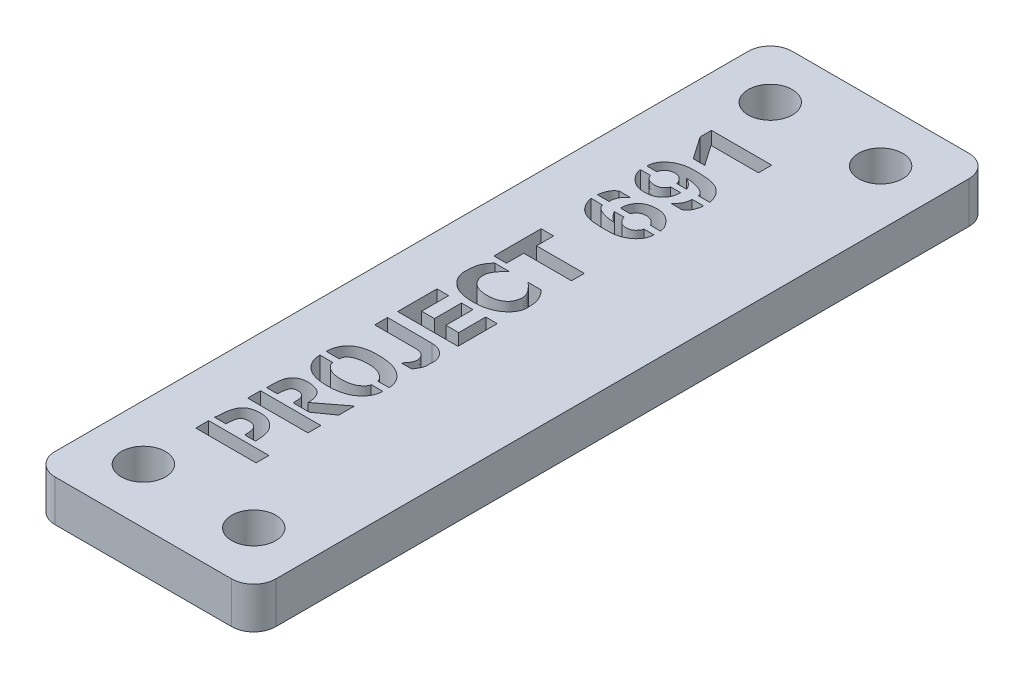
from build123d import *

# Parameters (mm, degrees)
SKETCH1_W           = 25.4
SKETCH1_H           = 84.836
BOSS_EXTRUDE1_DEPTH = 4.7625
FILLET1_R           = 2.54
SKETCH2_R           = 2.54
CUT_EXTRUDE1_DEPTH  = 4.7625
SKETCH3_W           = 6.937209635
SKETCH3_H           = 1.47773099
SKETCH3_H_2         = 1.477730989
CUT_EXTRUDE3_DEPTH  = 4.7625


with BuildPart() as part:
    # Sketch1 → Boss-Extrude1 (new body)
    with BuildSketch(Plane(origin=(0, 0, 0), x_dir=(1, 0, 0), z_dir=(0, 1, 0))):
        Rectangle(SKETCH1_W, SKETCH1_H)
    extrude(amount=BOSS_EXTRUDE1_DEPTH)

    # Fillet1
    fillet1_edges = [part.edges().sort_by_distance(p)[0] for p in [
        (-12.7, 2.38125, -42.418),
        (12.7, 2.38125, -42.418),
        (12.7, 2.38125, 42.418),
        (-12.7, 2.38125, 42.418),
    ]]
    fillet(fillet1_edges, radius=FILLET1_R)

    # Sketch2 → Cut-Extrude1 (cut)
    with BuildSketch(Plane(origin=(0, 4.7625, 0), x_dir=(1, 0, 0), z_dir=(0, 1, 0))):
        with Locations(Location((6.35, 36.068, 0), (0, 0, 270))):
            Circle(SKETCH2_R)
        with Locations(Location((-6.35, 36.068, 0), (0, 0, 270))):
            Circle(SKETCH2_R)
        with Locations(Location((6.35, -36.068, 0), (0, 0, 270))):
            Circle(SKETCH2_R)
        with Locations(Location((-6.35, -36.068, 0), (0, 0, 270))):
            Circle(SKETCH2_R)
    extrude(amount=-CUT_EXTRUDE1_DEPTH, mode=Mode.SUBTRACT)

    # Sketch3 → Cut-Extrude3 (cut)
    with BuildSketch(Plane(origin=(0, 4.7625, 0), x_dir=(1, 0, 0), z_dir=(0, 1, 0))):
        with BuildLine():
            Line((-2.204557943, -27.318811646), (-3.432489193, -27.318811646))
            add(Edge.make_bspline(
                [(-3.432489193, -27.318811646), (-3.432086244, -27.242043489), (-3.43131662, -27.095417788), (-3.444434951, -26.885090985), (-3.462893716, -26.694079451), (-3.490651172, -26.521824011), (-3.529286887, -26.369068947), (-3.578036003, -26.235963855), (-3.631503271, -26.119599112), (-3.700606609, -26.024876261), (-3.774751798, -25.94326573), (-3.859309551, -25.875236157), (-3.951313004, -25.81606595), (-4.052326275, -25.767662454), (-4.162419043, -25.732227657), (-4.279993593, -25.704130858), (-4.407280254, -25.690675175), (-4.539497775, -25.684071819), (-4.67120632, -25.68931151), (-4.795938487, -25.700663902), (-4.911135214, -25.720321161), (-5.01728325, -25.746758344), (-5.113551653, -25.782898874), (-5.20018799, -25.826377302), (-5.276644926, -25.878356426), (-5.345910846, -25.939667647), (-5.405748322, -26.021181454), (-5.455121107, -26.126788682), (-5.500796447, -26.257094486), (-5.534324196, -26.415150462), (-5.566678309, -26.59815323), (-5.589264627, -26.808329507), (-5.607848058, -27.044153478), (-5.613179732, -27.210425561), (-5.615979687, -27.297744198)],
                knots=[0, 0, 0, 0, 1.620059853, 3.094283102, 4.446036624, 5.669764395, 6.774058916, 7.765531304, 8.660548686, 9.465545705, 10.229819932, 10.982267153, 11.748884886, 12.535069155, 13.338672239, 14.18627352, 15.081979594, 16.035876351, 16.978779197, 17.861689262, 18.67809544, 19.443395835, 20.167134492, 20.8442956, 21.484521806, 22.114153355, 22.787578946, 23.602060283, 24.566476989, 25.696612031, 27.007394411, 28.488900441, 30.156128049, 32, 32, 32, 32], degree=3))
            Line((-5.615979687, -27.297744198), (-6.926675911, -27.297744198))
            add(Edge.make_bspline(
                [(-6.926675911, -27.297744198), (-6.921712564, -27.18334754), (-6.912149702, -26.962939926), (-6.889474751, -26.645831121), (-6.861772416, -26.354612775), (-6.825780895, -26.090107298), (-6.783941902, -25.851579213), (-6.736724336, -25.638719824), (-6.681792385, -25.45199614), (-6.619050018, -25.289274235), (-6.549930048, -25.145269935), (-6.475368605, -25.013851842), (-6.391670351, -24.895266674), (-6.304488565, -24.785514263), (-6.20972416, -24.687152478), (-6.106551853, -24.601539985), (-5.998363784, -24.525480797), (-5.84144082, -24.439916569), (-5.624638239, -24.353975928), (-5.338004568, -24.280368922), (-5.019882446, -24.239015253), (-4.73772238, -24.225933909), (-4.503107017, -24.233735716), (-4.327486567, -24.249429272), (-4.156796234, -24.278965653), (-3.990195633, -24.3168429), (-3.8297448, -24.371191099), (-3.672415085, -24.431572528), (-3.521002812, -24.506675475), (-3.374664778, -24.591583863), (-3.235441884, -24.686356673), (-3.104154991, -24.787205163), (-2.981621264, -24.89435255), (-2.868204891, -25.008408891), (-2.766398735, -25.131578913), (-2.670787271, -25.258608179), (-2.586590412, -25.394214474), (-2.508470134, -25.536587596), (-2.43904046, -25.693136489), (-2.382088863, -25.868028067), (-2.330052116, -26.061697568), (-2.28953676, -26.275159671), (-2.254184606, -26.507963608), (-2.229965258, -26.760683599), (-2.211124708, -27.033142019), (-2.206795653, -27.221466011), (-2.204557943, -27.318811646)],
                knots=[0, 0, 0, 0, 1.699189764, 3.273822559, 4.717445749, 6.039702003, 7.234168391, 8.310453345, 9.273716079, 10.119740721, 10.895518061, 11.642474635, 12.359027655, 13.047258987, 13.721088708, 14.381587928, 15.034110984, 15.680490903, 17.029629755, 18.483046039, 20.061106175, 21.782264105, 22.668591867, 23.543372224, 24.396343774, 25.237738208, 26.075767183, 26.907923794, 27.736877995, 28.580804131, 29.416979643, 30.23438941, 31.03619414, 31.831023051, 32.618286661, 33.405866943, 34.188612909, 34.984695714, 35.814585228, 36.725577301, 37.711441232, 38.788832536, 39.947912176, 41.204878494, 42.555187395, 44, 44, 44, 44], degree=3))
        make_face()
        with Locations((-3.468604818, -28.712272844)):
            Rectangle(SKETCH3_W, SKETCH3_H)
        with Locations((-3.468604818, -22.741156178)):
            Rectangle(SKETCH3_W, SKETCH3_H_2)
        with BuildLine():
            add(Edge.make_bspline(
                [(-3.84781888, -21.337161256), (-3.847753872, -21.265926003), (-3.847629287, -21.129407572), (-3.856412298, -20.93355259), (-3.873130803, -20.756378239), (-3.89422301, -20.597685736), (-3.925514345, -20.458660199), (-3.964855298, -20.338957205), (-4.008862139, -20.236185284), (-4.063781239, -20.151428397), (-4.128253534, -20.083185163), (-4.195373034, -20.020966344), (-4.273923765, -19.972273328), (-4.358233929, -19.928678985), (-4.451978172, -19.898349054), (-4.552643244, -19.875213633), (-4.66106172, -19.862255319), (-4.774288702, -19.857911775), (-4.88643986, -19.862473824), (-4.992170249, -19.874073649), (-5.088903823, -19.893580882), (-5.176763692, -19.919831106), (-5.254934344, -19.956278497), (-5.322499717, -20.001998193), (-5.382848358, -20.053485938), (-5.434618007, -20.116041305), (-5.477796034, -20.195189439), (-5.513801737, -20.29396158), (-5.548974097, -20.41391277), (-5.577494774, -20.55710614), (-5.604854555, -20.722633409), (-5.626833921, -20.910969515), (-5.644452056, -21.121798523), (-5.65341092, -21.269924536), (-5.658114583, -21.34769498)],
                knots=[0, 0, 0, 0, 1.704020633, 3.265661473, 4.687782663, 5.960558721, 7.092940044, 8.090949425, 8.971855951, 9.760657708, 10.491171539, 11.213658047, 11.942593241, 12.693902549, 13.479411519, 14.291598235, 15.162311024, 16.087000325, 16.999698994, 17.845156185, 18.628829851, 19.357567475, 20.033937485, 20.682928481, 21.303797403, 21.926056331, 22.613721948, 23.449414641, 24.436762231, 25.60173672, 26.93927573, 28.450017959, 30.1361567, 32, 32, 32, 32], degree=3))
            Line((-5.658114583, -21.34769498), (-6.907113281, -21.34769498))
            add(Edge.make_bspline(
                [(-6.907113281, -21.34769498), (-6.90682114, -21.22980228), (-6.906261587, -21.003997057), (-6.894238821, -20.680482609), (-6.881787593, -20.38717533), (-6.856193437, -20.1249368), (-6.829476564, -19.892639907), (-6.793612056, -19.691165929), (-6.752510206, -19.519862307), (-6.68978001, -19.334857686), (-6.588099061, -19.139505957), (-6.442249963, -18.935053685), (-6.263862306, -18.767229212), (-6.060311779, -18.632384798), (-5.834664977, -18.53161419), (-5.593774188, -18.45675038), (-5.337194887, -18.413966326), (-5.069279876, -18.399775581), (-4.797286243, -18.412218728), (-4.527748811, -18.448112576), (-4.264957544, -18.509025033), (-4.051778129, -18.577795298), (-3.888464716, -18.647363989), (-3.773840392, -18.708883966), (-3.667821705, -18.780352169), (-3.569622631, -18.859951386), (-3.480426153, -18.949258895), (-3.399855969, -19.048142343), (-3.328371497, -19.156577345), (-3.240615154, -19.313216413), (-3.153034087, -19.528605262), (-3.080046601, -19.808970902), (-3.033969671, -20.11273115), (-3.028839124, -20.323744903), (-3.026188411, -20.432765813)],
                knots=[0, 0, 0, 0, 1.545689895, 2.960529795, 4.244762436, 5.394017444, 6.414580785, 7.309945393, 8.075641602, 8.72251512, 9.866752923, 10.949451079, 12.000892828, 13.058917368, 14.136147873, 15.230450672, 16.35823801, 17.537386422, 18.742157286, 19.923486542, 21.0977639, 22.274984682, 22.855342685, 23.423306737, 23.977859707, 24.529479651, 25.078269143, 25.629889087, 26.199032476, 26.779092248, 27.98221028, 29.234586207, 30.571240389, 32, 32, 32, 32], degree=3))
            Line((-3.026188411, -20.432765813), (0, -18.122870631))
            Line((0, -18.122870631), (0, -19.933166334))
            Line((0, -19.933166334), (-1.986359375, -21.337161256))
            Line((-1.986359375, -21.337161256), (-3.84781888, -21.337161256))
        make_face()
        with BuildLine():
            add(Edge.make_bspline(
                [(-1.17526263, -14.302138469), (-1.176933137, -14.270320689), (-1.180340607, -14.205419324), (-1.211408481, -14.10939091), (-1.259105899, -14.013500009), (-1.324990391, -13.916470126), (-1.409867757, -13.818610025), (-1.514991417, -13.721397576), (-1.636947573, -13.622137312), (-1.775605988, -13.523710973), (-1.92952388, -13.430176335), (-2.099041038, -13.349129248), (-2.280756724, -13.280266035), (-2.47540848, -13.223881852), (-2.682505224, -13.183037248), (-2.902068659, -13.152836031), (-3.134201346, -13.134649564), (-3.375341466, -13.131311582), (-3.61626525, -13.137306834), (-3.848870711, -13.15140983), (-4.068120674, -13.177746639), (-4.275819162, -13.210050723), (-4.471102199, -13.252966051), (-4.653462371, -13.308176594), (-4.824324934, -13.368543178), (-4.980858056, -13.440815051), (-5.121393437, -13.521277307), (-5.245691328, -13.608116842), (-5.348101515, -13.705591479), (-5.434800426, -13.808282107), (-5.500001896, -13.920980862), (-5.545735921, -14.041376551), (-5.571841994, -14.169580802), (-5.57416518, -14.25737723), (-5.575349609, -14.302138469)],
                knots=[0, 0, 0, 0, 0.559551673, 1.141363957, 1.762179237, 2.443913102, 3.20250351, 4.040654274, 4.964481152, 5.97279125, 7.03575374, 8.135123237, 9.279679308, 10.457759393, 11.702785314, 12.996979229, 14.362738502, 15.804190176, 17.245831659, 18.610331059, 19.909950123, 21.136790735, 22.314472596, 23.430673126, 24.493525292, 25.506283696, 26.464789682, 27.34564422, 28.171296493, 28.950175142, 29.70690828, 30.454076609, 31.211842126, 32, 32, 32, 32], degree=3))
            Line((-5.575349609, -14.302138469), (-7.072643229, -14.302138469))
            add(Edge.make_bspline(
                [(-7.072643229, -14.302138469), (-7.070053996, -14.205688359), (-7.064974851, -14.016487887), (-7.024691446, -13.739763459), (-6.960781089, -13.476069688), (-6.868281915, -13.22693284), (-6.750778594, -12.991505893), (-6.604026538, -12.772136693), (-6.433764246, -12.565290762), (-6.236821326, -12.372530739), (-6.01076592, -12.197738151), (-5.750124588, -12.051409606), (-5.460800465, -11.924891132), (-5.13802578, -11.827830796), (-4.785007759, -11.750581216), (-4.399835445, -11.701093834), (-3.983692041, -11.674714797), (-3.546103019, -11.672385111), (-3.107073646, -11.692760084), (-2.686691187, -11.734918395), (-2.295496895, -11.802582549), (-1.933081824, -11.892281141), (-1.59861989, -12.004436696), (-1.292824692, -12.141467058), (-1.015849258, -12.302270854), (-0.770312417, -12.486814989), (-0.554714903, -12.686293548), (-0.36247581, -12.891080884), (-0.204973892, -13.108560267), (-0.070943722, -13.330171343), (0.029185523, -13.562592647), (0.105113723, -13.801550129), (0.146968569, -14.049869881), (0.153311394, -14.217727225), (0.156501042, -14.302138469)],
                knots=[0, 0, 0, 0, 0.920346871, 1.805389965, 2.663603329, 3.505921104, 4.336769663, 5.169437479, 6.019773897, 6.889978583, 7.795002015, 8.738717905, 9.735886095, 10.803615248, 11.950360416, 13.182160892, 14.506515913, 15.928648215, 17.357110269, 18.700219705, 19.958946806, 21.143485947, 22.260957422, 23.321793063, 24.336827028, 25.311708212, 26.247066261, 27.138304861, 27.987778048, 28.805680415, 29.605441448, 30.397525795, 31.194155961, 32, 32, 32, 32], degree=3))
            Line((0.156501042, -14.302138469), (-1.17526263, -14.302138469))
        make_face()
        with BuildLine():
            add(Edge.make_bspline(
                [(0.156501042, -15.03047024), (0.153682672, -15.1199529), (0.148104172, -15.297069145), (0.101349859, -15.557277814), (0.026212212, -15.80828382), (-0.082116267, -16.048061729), (-0.218545806, -16.279332634), (-0.386976583, -16.498830253), (-0.584534167, -16.709478238), (-0.810458157, -16.908603269), (-1.065092754, -17.090834972), (-1.346085708, -17.250971347), (-1.653418937, -17.38507378), (-1.98612729, -17.492130722), (-2.343135439, -17.578387266), (-2.725502238, -17.639413191), (-3.133326905, -17.67454055), (-3.556880155, -17.685710937), (-3.978977862, -17.67481494), (-4.381566132, -17.638977775), (-4.756468423, -17.581251044), (-5.103159616, -17.499520659), (-5.421722405, -17.392494242), (-5.711549193, -17.262130559), (-5.973515335, -17.107787394), (-6.205448706, -16.929811976), (-6.408609528, -16.733376267), (-6.58593024, -16.524578273), (-6.737467082, -16.304868716), (-6.860372979, -16.072456399), (-6.955862639, -15.828611624), (-7.023367495, -15.572644415), (-7.065142939, -15.3052195), (-7.070119512, -15.122918576), (-7.072643229, -15.03047024)],
                knots=[0, 0, 0, 0, 0.853788275, 1.689933833, 2.515604473, 3.349525323, 4.195487693, 5.073811264, 5.985247159, 6.948898209, 7.944298668, 8.969549936, 10.03104821, 11.139619114, 12.302323729, 13.534477937, 14.832609361, 16.207589621, 17.577782735, 18.861604178, 20.063875084, 21.196402976, 22.258020076, 23.267502423, 24.225161109, 25.154278776, 26.051819322, 26.918259964, 27.765739173, 28.594805511, 29.42276458, 30.260307849, 31.117768349, 32, 32, 32, 32], degree=3))
            Line((-7.072643229, -15.03047024), (-5.596417057, -15.03047024))
            add(Edge.make_bspline(
                [(-5.596417057, -15.03047024), (-5.59418075, -15.063796608), (-5.589630293, -15.131609384), (-5.558360923, -15.231422111), (-5.515055036, -15.332306207), (-5.451762082, -15.431565785), (-5.372985397, -15.531242211), (-5.276876069, -15.630499075), (-5.165845271, -15.731248558), (-5.038232395, -15.830259566), (-4.894168149, -15.924618009), (-4.730936409, -16.004564907), (-4.55257462, -16.074781774), (-4.357017638, -16.128804518), (-4.145897111, -16.175601915), (-3.917067755, -16.203045001), (-3.672661376, -16.223892169), (-3.416924159, -16.22838678), (-3.16077646, -16.223552934), (-2.91399163, -16.204200131), (-2.682886983, -16.171123665), (-2.466737835, -16.127075987), (-2.266854536, -16.067430889), (-2.08132654, -15.997918566), (-1.911297476, -15.913275878), (-1.758987956, -15.815372223), (-1.624246377, -15.712317058), (-1.505022047, -15.610972656), (-1.404417058, -15.511199701), (-1.321562253, -15.412104382), (-1.256175433, -15.315267527), (-1.210055351, -15.219007303), (-1.180810879, -15.124473852), (-1.177079775, -15.061258001), (-1.17526263, -15.03047024)],
                knots=[0, 0, 0, 0, 0.586688794, 1.193799336, 1.831051319, 2.517875258, 3.260615898, 4.067157841, 4.949574073, 5.90085298, 6.911050796, 7.978417371, 9.097950677, 10.284242926, 11.549887516, 12.905094796, 14.34172073, 15.871388074, 17.409892715, 18.855330142, 20.230456225, 21.522043046, 22.738739217, 23.902689247, 25.009587917, 26.078746574, 27.088247994, 27.99718535, 28.834762146, 29.581751398, 30.270676851, 30.887491563, 31.458179498, 32, 32, 32, 32], degree=3))
            Line((-1.17526263, -15.03047024), (0.156501042, -15.03047024))
        make_face()
        with BuildLine():
            Line((-6.926675911, -8.874260995), (-6.926675911, -7.396530006))
            Line((-6.926675911, -7.396530006), (-1.810295703, -7.40706373))
            add(Edge.make_bspline(
                [(-1.810295703, -7.40706373), (-1.737491363, -7.41052985), (-1.594878071, -7.417319483), (-1.386499947, -7.445032674), (-1.190774984, -7.493028043), (-1.004816741, -7.551940229), (-0.831688895, -7.631543927), (-0.667975095, -7.724305188), (-0.516521254, -7.835432556), (-0.378172376, -7.960777291), (-0.25412853, -8.096328746), (-0.143167563, -8.235530312), (-0.05141616, -8.380838461), (0.024520868, -8.528792311), (0.084108043, -8.680887215), (0.12645489, -8.837251454), (0.150201643, -8.99790952), (0.160156589, -9.20874337), (0.153890153, -9.45467783), (0.146907522, -9.720699429), (0.131465329, -9.943996328), (0.115783383, -10.107177103), (0.090863992, -10.227974972), (0.057980888, -10.324364871), (0.012549682, -10.432105779), (-0.045635935, -10.551906857), (-0.115460621, -10.683485682), (-0.201493097, -10.825532778), (-0.298437732, -10.979808985), (-0.369393692, -11.085527797), (-0.406300781, -11.140516464)],
                knots=[0, 0, 0, 0, 1.215774492, 2.38152841, 3.499943313, 4.574381322, 5.630576831, 6.672721368, 7.70883401, 8.757576902, 9.782134528, 10.77153606, 11.723382411, 12.644074726, 13.542320429, 14.443640527, 15.340755012, 16.245951772, 17.961585553, 19.443669169, 20.685038119, 21.696074975, 22.17535241, 22.739034778, 23.391781445, 24.125402853, 24.96028863, 25.875946883, 26.89519331, 28, 28, 28, 28], degree=3))
            Line((-0.406300781, -11.140516464), (-1.611659766, -11.140516464))
            add(Edge.make_bspline(
                [(-1.611659766, -11.140516464), (-1.555645054, -11.078522913), (-1.448822709, -10.960298677), (-1.308906829, -10.779901208), (-1.189713752, -10.610321257), (-1.096478603, -10.447986801), (-1.024765342, -10.294953361), (-0.979608093, -10.149658065), (-0.953773005, -10.01284842), (-0.960902551, -9.846074019), (-0.998009172, -9.656944514), (-1.071881974, -9.451413305), (-1.1813056, -9.275221289), (-1.298666603, -9.153224388), (-1.406713319, -9.070208795), (-1.499099073, -9.017699508), (-1.60115052, -8.974763671), (-1.711287435, -8.936162059), (-1.831903376, -8.908199982), (-1.961795014, -8.889231691), (-2.100994033, -8.876914629), (-2.197006503, -8.87516594), (-2.246692839, -8.874260995)],
                knots=[0, 0, 0, 0, 1.52682091, 2.911709905, 4.170758681, 5.312664321, 6.330329213, 7.252596346, 8.089247554, 8.859715672, 10.287649864, 11.599132905, 12.830633069, 14.049885, 14.671597463, 15.31647816, 15.985924738, 16.693474089, 17.447450553, 18.244998475, 19.091788859, 20, 20, 20, 20], degree=3))
            Line((-2.246692839, -8.874260995), (-6.926675911, -8.874260995))
        make_face()
        Polygon((-6.9342, -6.224277011), (-6.9342, -1.699290162), (-5.585883333, -1.699290162), (-5.585883333, -4.809748365), (-4.114171615, -4.809748365), (-4.114171615, -1.699290162), (-2.792941667, -1.699290162), (-2.792941667, -4.809748365), (-1.321229948, -4.809748365), (-1.321229948, -1.699290162), (0, -1.699290162), (0, -6.224277011), align=None)
        with BuildLine():
            add(Edge.make_bspline(
                [(-0.842697917, 4.192071166), (-0.769155384, 4.11651892), (-0.623127453, 3.966500452), (-0.428226109, 3.721399238), (-0.259086872, 3.461441745), (-0.132648637, 3.234829883), (-0.047733057, 3.039675523), (0.007232967, 2.87911242), (0.054255663, 2.704721472), (0.091015358, 2.516010768), (0.12107844, 2.313702338), (0.142178703, 2.097237217), (0.1528624, 1.867244059), (0.159707987, 1.626778524), (0.147385278, 1.381060154), (0.099928562, 1.138647294), (0.020709213, 0.903047376), (-0.090344043, 0.675055398), (-0.231516128, 0.453788697), (-0.404676742, 0.240816424), (-0.609932145, 0.036006896), (-0.842400789, -0.161257333), (-1.102267116, -0.343066786), (-1.386043775, -0.503262375), (-1.69320913, -0.637433939), (-2.023236361, -0.744898813), (-2.374785527, -0.830773906), (-2.749026303, -0.892300224), (-3.145853845, -0.927323762), (-3.556880642, -0.938638188), (-3.965949957, -0.927603002), (-4.357625146, -0.89195761), (-4.723517118, -0.832736517), (-5.064457338, -0.74861917), (-5.379696315, -0.640294932), (-5.671176081, -0.509967095), (-5.936091205, -0.352707463), (-6.173623719, -0.171991912), (-6.382760992, 0.025535856), (-6.568631257, 0.22948743), (-6.723081502, 0.445205546), (-6.850134276, 0.668667619), (-6.95100804, 0.900372388), (-7.021642789, 1.140989481), (-7.064882009, 1.389977952), (-7.074850144, 1.642832456), (-7.071570956, 1.890868097), (-7.058179175, 2.127074934), (-7.044003615, 2.347762777), (-7.016911492, 2.551808091), (-6.987231377, 2.740710659), (-6.945184801, 2.912849843), (-6.902237168, 3.070867947), (-6.827899923, 3.257914716), (-6.719513587, 3.477719511), (-6.563606885, 3.728919105), (-6.379609839, 3.968979798), (-6.239341642, 4.117032031), (-6.168247786, 4.192071166)],
                knots=[0, 0, 0, 0, 1.142102602, 2.267788091, 3.386469574, 4.500532407, 5.075110759, 5.690534852, 6.337967116, 7.030899795, 7.772743646, 8.553780998, 9.38659623, 10.267348619, 11.16047737, 12.046381184, 12.93508228, 13.846776553, 14.787737289, 15.77335943, 16.815008932, 17.925831272, 19.073418424, 20.246596944, 21.451460151, 22.699425793, 24.003318156, 25.369697712, 26.805256227, 28.317037304, 29.823384826, 31.237291449, 32.575969623, 33.836339543, 35.037948929, 36.183770988, 37.29034247, 38.36882713, 39.411043808, 40.404177068, 41.354558347, 42.279605007, 43.185365136, 44.086628527, 44.991001142, 45.916383134, 46.824228694, 47.678758263, 48.480056567, 49.219686519, 49.908684965, 50.550801302, 51.139176072, 51.681260279, 52.729033148, 53.790965847, 54.880368043, 56, 56, 56, 56], degree=3))
            Line((-6.168247786, 4.192071166), (-4.451250781, 4.192071166))
            add(Edge.make_bspline(
                [(-4.451250781, 4.192071166), (-4.545595179, 4.108424617), (-4.726484314, 3.948046765), (-4.969959057, 3.699645969), (-5.174444541, 3.456039217), (-5.340277169, 3.217507363), (-5.468565723, 2.984886842), (-5.560088003, 2.757411227), (-5.611269613, 2.533819734), (-5.622588252, 2.316762554), (-5.603795688, 2.110828345), (-5.571478966, 1.915829236), (-5.522324346, 1.732301504), (-5.45372998, 1.561839046), (-5.370669601, 1.401816101), (-5.270009135, 1.253473736), (-5.149106912, 1.119692032), (-5.015364731, 0.995112517), (-4.864239579, 0.885138398), (-4.697531826, 0.790900478), (-4.517921002, 0.708306259), (-4.322534928, 0.644916536), (-4.113824759, 0.593685961), (-3.89112755, 0.555628488), (-3.653581358, 0.536057126), (-3.406908278, 0.528170842), (-3.159230082, 0.536086437), (-2.920295161, 0.555860089), (-2.695152433, 0.592511351), (-2.483448858, 0.641260841), (-2.285845645, 0.706472568), (-2.100909846, 0.784238604), (-1.93039185, 0.878163131), (-1.773170576, 0.984886379), (-1.631412505, 1.105021915), (-1.507014715, 1.23823385), (-1.400414858, 1.38430151), (-1.312302881, 1.542922335), (-1.238213506, 1.712616528), (-1.187010542, 1.895705891), (-1.15098072, 2.090096905), (-1.129858317, 2.295424925), (-1.136410198, 2.513113664), (-1.191731208, 2.737102226), (-1.282805687, 2.96796972), (-1.418077593, 3.202490392), (-1.591803852, 3.443661125), (-1.80770186, 3.688990614), (-2.060133584, 3.944944065), (-2.250865254, 4.107259202), (-2.35052526, 4.192071166)],
                knots=[0, 0, 0, 0, 1.644457997, 3.152964999, 4.532843094, 5.788876873, 6.936739459, 7.991466232, 8.977304869, 9.914492674, 10.81384118, 11.670143911, 12.49082873, 13.286722025, 14.062344171, 14.839152306, 15.617859763, 16.409734935, 17.219891492, 18.049372533, 18.904474348, 19.794249952, 20.724260177, 21.706421881, 22.73783236, 23.831091397, 24.924350434, 25.968796894, 26.956349637, 27.897549355, 28.799749926, 29.667551167, 30.510955973, 31.334947132, 32.142642367, 32.929717677, 33.707159434, 34.495267687, 35.292612216, 36.116837179, 36.96900467, 37.869495086, 38.806043048, 39.793335612, 40.862637167, 42.034641504, 43.314850825, 44.734359334, 46.293656371, 48, 48, 48, 48], degree=3))
            Line((-2.35052526, 4.192071166), (-0.842697917, 4.192071166))
        make_face()
        Polygon((-6.9342, 4.855695776), (-6.9342, 10.285078067), (-5.489575, 10.285078067), (-5.489575, 8.318281322), (0, 8.318281322), (0, 6.842055151), (-5.489575, 6.842055151), (-5.489575, 4.855695776), align=None)
        with BuildLine():
            add(Edge.make_bspline(
                [(-5.751413281, 16.907780802), (-5.749215461, 16.984683116), (-5.74488097, 17.136348105), (-5.70701531, 17.358732387), (-5.648874903, 17.573241165), (-5.563726077, 17.77962671), (-5.450960019, 17.97869527), (-5.308881161, 18.17089911), (-5.139007888, 18.358207246), (-5.007807394, 18.471628998), (-4.940316536, 18.529974291)],
                knots=[0, 0, 0, 0, 0.981416672, 1.935527552, 2.872649936, 3.814794331, 4.77857579, 5.786904786, 6.861561505, 8, 8, 8, 8], degree=3))
            Line((-4.940316536, 18.529974291), (-6.189315234, 18.529974291))
            add(Edge.make_bspline(
                [(-6.189315234, 18.529974291), (-6.230373017, 18.504535397), (-6.311612887, 18.45420018), (-6.424654108, 18.368315422), (-6.526412863, 18.274750497), (-6.619783282, 18.176689433), (-6.701110714, 18.070265007), (-6.773516088, 17.957728936), (-6.835253885, 17.838023673), (-6.902918196, 17.675950201), (-6.965375757, 17.480249218), (-7.025977085, 17.265418812), (-7.063575025, 17.077615935), (-7.069797312, 16.961080967), (-7.072643229, 16.907780802)],
                knots=[0, 0, 0, 0, 0.902701417, 1.786149687, 2.649151757, 3.485131382, 4.314244312, 5.149329194, 5.984045373, 6.828816213, 8.430272808, 9.820342073, 11.003079253, 12, 12, 12, 12], degree=3))
            Line((-7.072643229, 16.907780802), (-5.751413281, 16.907780802))
        make_face()
        with BuildLine():
            add(Edge.make_bspline(
                [(-3.275988151, 16.907780802), (-3.271472985, 16.936853378), (-3.260925134, 17.004769637), (-3.19995319, 17.108849219), (-3.105417788, 17.226292967), (-3.007471412, 17.335577247), (-2.909610972, 17.422526039), (-2.825854647, 17.482904508), (-2.733495927, 17.532921439), (-2.635019648, 17.575186594), (-2.528326882, 17.606567263), (-2.415006009, 17.6290616), (-2.294174951, 17.642431342), (-2.168467067, 17.64633171), (-2.041991202, 17.643202597), (-1.919781218, 17.625795255), (-1.803510134, 17.600348247), (-1.692524289, 17.566274453), (-1.588519672, 17.519540467), (-1.491766882, 17.460917003), (-1.399090162, 17.395744068), (-1.317085632, 17.318728261), (-1.243137862, 17.242191786), (-1.176254385, 17.172609945), (-1.119156261, 17.111268204), (-1.071971018, 17.057882167), (-1.037371693, 17.010659545), (-1.011940058, 16.972760331), (-0.992370219, 16.943626411), (-0.989726183, 16.924488858), (-0.988665234, 16.916809708)],
                knots=[0, 0, 0, 0, 0.848617324, 1.982449431, 3.436545942, 5.240768766, 6.231652679, 7.234248317, 8.231856677, 9.276340032, 10.341049835, 11.455338972, 12.628184927, 13.867293084, 15.106401241, 16.297295494, 17.446097863, 18.561148647, 19.663179848, 20.747543236, 21.843297207, 22.946771928, 24.007887427, 24.935260928, 25.749674447, 26.44180137, 27.004159656, 27.444606052, 27.777142173, 28, 28, 28, 28], degree=3))
            Line((-0.988665234, 16.916809708), (0.156501042, 16.916809708))
            add(Edge.make_bspline(
                [(0.156501042, 16.916809708), (0.154509189, 16.970144389), (0.150450726, 17.078815523), (0.115381471, 17.241517099), (0.060283162, 17.405741311), (-0.015776273, 17.572203299), (-0.113863452, 17.740299816), (-0.234505949, 17.909367015), (-0.374596287, 18.081403886), (-0.535087588, 18.251193317), (-0.708905864, 18.415102084), (-0.899419935, 18.5562271), (-1.099760707, 18.676827436), (-1.310994886, 18.774098075), (-1.532330797, 18.852339967), (-1.764698968, 18.905335891), (-2.007358557, 18.939285958), (-2.256243642, 18.948392518), (-2.503095447, 18.939244307), (-2.739776194, 18.91476061), (-2.962432497, 18.871076079), (-3.171253776, 18.809587888), (-3.365735094, 18.729619432), (-3.546572364, 18.633426101), (-3.711314326, 18.517667221), (-3.862241262, 18.387123025), (-3.995702326, 18.241039595), (-4.112536564, 18.083130344), (-4.212656202, 17.914711059), (-4.291786984, 17.733748737), (-4.356565307, 17.543341129), (-4.398432169, 17.340587606), (-4.426951015, 17.127792167), (-4.430087576, 16.982117853), (-4.431688151, 16.907780802)],
                knots=[0, 0, 0, 0, 0.750355394, 1.528873324, 2.332989369, 3.186468007, 4.101149326, 5.069252908, 6.10844306, 7.222788785, 8.357455092, 9.46783137, 10.554430822, 11.644697357, 12.737066891, 13.854162738, 14.99494648, 16.182633948, 17.355930564, 18.471372678, 19.529710703, 20.546576165, 21.531666437, 22.486067545, 23.424654872, 24.360900384, 25.290755979, 26.204782513, 27.123029643, 28.043176503, 28.981311889, 29.949724638, 30.953752245, 32, 32, 32, 32], degree=3))
            Line((-4.431688151, 16.907780802), (-3.275988151, 16.907780802))
        make_face()
        with BuildLine():
            Line((0.167034766, 16.168915307), (-0.97813151, 16.168915307))
            add(Edge.make_bspline(
                [(-0.97813151, 16.168915307), (-0.984082939, 16.127663033), (-0.997128094, 16.037240664), (-1.068436363, 15.901983661), (-1.170099069, 15.752746028), (-1.281787375, 15.624164081), (-1.386338389, 15.521185154), (-1.475638921, 15.451851781), (-1.571433815, 15.394212714), (-1.673085329, 15.344341061), (-1.782004596, 15.309950765), (-1.896270635, 15.280876287), (-2.017634672, 15.267960547), (-2.142856443, 15.260527576), (-2.267604273, 15.267843524), (-2.388407862, 15.281087241), (-2.5018066, 15.309665508), (-2.609593915, 15.344470672), (-2.709650926, 15.393692859), (-2.802867691, 15.452904924), (-2.891749874, 15.52021824), (-2.993216817, 15.625202735), (-3.102060302, 15.756815566), (-3.202031108, 15.913828071), (-3.267785111, 16.06333098), (-3.280542409, 16.162883959), (-3.286521875, 16.209545385)],
                knots=[0, 0, 0, 0, 0.927475074, 2.032966586, 3.375798686, 4.976803487, 5.834806498, 6.659437564, 7.501332334, 8.335396756, 9.187940833, 10.054359069, 10.971160572, 11.915823181, 12.860485791, 13.766139725, 14.632557961, 15.474452731, 16.298394914, 17.121187677, 17.945818743, 18.787788451, 20.384333895, 21.761999943, 22.951028129, 24, 24, 24, 24], degree=3))
            Line((-3.286521875, 16.209545385), (-4.431688151, 16.209545385))
            add(Edge.make_bspline(
                [(-4.431688151, 16.209545385), (-4.43033138, 16.204965798), (-4.42634918, 16.191524452), (-4.410990235, 16.168396225), (-4.390429985, 16.132468079), (-4.358273424, 16.08724439), (-4.319164159, 16.029249096), (-4.271234281, 15.960347427), (-4.213804932, 15.880762977), (-4.12510099, 15.757919093), (-3.992306514, 15.598975766), (-3.79642281, 15.422596807), (-3.566834061, 15.255251892), (-3.396441555, 15.158480741), (-3.307589323, 15.108018822)],
                knots=[0, 0, 0, 0, 0.107234925, 0.314740585, 0.61909808, 1.04234032, 1.562795012, 2.196197582, 2.933359156, 3.774392159, 5.611037011, 7.587220186, 9.698928515, 12, 12, 12, 12], degree=3))
            add(Edge.make_bspline(
                [(-3.307589323, 15.108018822), (-3.396427634, 15.112798938), (-3.570352881, 15.122157319), (-3.824272558, 15.148294809), (-4.065220443, 15.181163702), (-4.292955134, 15.220999277), (-4.50712411, 15.271358881), (-4.709076494, 15.327404792), (-4.897600926, 15.394419445), (-5.072557629, 15.466538729), (-5.229319114, 15.546193307), (-5.368180131, 15.62702524), (-5.485450235, 15.711987446), (-5.581521697, 15.799714206), (-5.658009859, 15.88920577), (-5.710955481, 15.983298011), (-5.745343946, 16.080309135), (-5.749400759, 16.146575375), (-5.751413281, 16.179449031)],
                knots=[0, 0, 0, 0, 1.499814804, 2.936296909, 4.302182762, 5.59947636, 6.832403556, 8.010357135, 9.131089549, 10.20385637, 11.198577165, 12.09348467, 12.910514558, 13.634730622, 14.283349854, 14.885477346, 15.447102571, 16, 16, 16, 16], degree=3))
            Line((-5.751413281, 16.179449031), (-7.072643229, 16.189982755))
            add(Edge.make_bspline(
                [(-7.072643229, 16.189982755), (-7.072225471, 16.169353526), (-7.071322508, 16.124764522), (-7.056657178, 16.054402908), (-7.041915423, 15.973851223), (-7.014075207, 15.885295953), (-6.984383653, 15.785967725), (-6.94120358, 15.679532111), (-6.898092446, 15.561756348), (-6.825156149, 15.396185164), (-6.72127449, 15.188853674), (-6.567367539, 14.955532129), (-6.384238624, 14.743469374), (-6.176122517, 14.549426977), (-5.938986702, 14.378717066), (-5.671938824, 14.235130783), (-5.377551436, 14.116952243), (-5.110335629, 14.039099462), (-4.874872056, 13.99033156), (-4.673114958, 13.95718399), (-4.448577152, 13.930984579), (-4.201696527, 13.908620392), (-3.932288452, 13.890390059), (-3.640229995, 13.879015397), (-3.325687586, 13.872011874), (-2.995041466, 13.867164324), (-2.660435678, 13.876464036), (-2.334863018, 13.905259328), (-2.025691105, 13.958438047), (-1.732480793, 14.030777563), (-1.454188775, 14.12141925), (-1.193480651, 14.236890841), (-0.947945933, 14.370592503), (-0.722093029, 14.525538475), (-0.516341268, 14.693993268), (-0.336454436, 14.875137853), (-0.182463953, 15.065627116), (-0.057090941, 15.26690343), (0.042738645, 15.477551505), (0.11106089, 15.699686358), (0.156645934, 15.930834852), (0.16354514, 16.08894368), (0.167034766, 16.168915307)],
                knots=[0, 0, 0, 0, 0.258221721, 0.558132818, 0.898640276, 1.28488583, 1.720575915, 2.19841396, 2.72412238, 3.293240168, 4.466418006, 5.628394464, 6.788325788, 7.972365138, 9.18920409, 10.441809878, 11.765322105, 13.160831415, 13.925755206, 14.779982171, 15.724097867, 16.760064261, 17.888611064, 19.11002675, 20.425140591, 21.834293582, 23.256653412, 24.621237559, 25.92947289, 27.18665111, 28.406072673, 29.59473182, 30.757474276, 31.907297446, 33.024443337, 34.087556567, 35.103387964, 36.089590438, 37.054866171, 38.017802335, 38.997402139, 40, 40, 40, 40], degree=3))
        make_face()
        with BuildLine():
            Line((0.145967318, 21.900765958), (-1.17526263, 21.900765958))
            add(Edge.make_bspline(
                [(-1.17526263, 21.900765958), (-1.177505176, 21.823876114), (-1.181927875, 21.67223572), (-1.219172279, 21.449538092), (-1.279765212, 21.235571565), (-1.364329989, 21.028895771), (-1.477194531, 20.829802452), (-1.61935432, 20.6381586), (-1.787615358, 20.449836818), (-1.918763819, 20.336821814), (-1.986359375, 20.278572468)],
                knots=[0, 0, 0, 0, 0.981732815, 1.936151043, 2.87530384, 3.817751729, 4.781843651, 5.79049746, 6.86119478, 8, 8, 8, 8], degree=3))
            Line((-1.986359375, 20.278572468), (-0.738865495, 20.278572468))
            add(Edge.make_bspline(
                [(-0.738865495, 20.278572468), (-0.697772937, 20.303975459), (-0.61646426, 20.354239637), (-0.504194003, 20.440439298), (-0.400546562, 20.532094206), (-0.309654668, 20.632327809), (-0.224777199, 20.73626278), (-0.153477858, 20.849518801), (-0.090981036, 20.968610693), (-0.026354222, 21.131918856), (0.039361283, 21.326371051), (0.099379051, 21.542137812), (0.136812594, 21.730442469), (0.143102564, 21.847467266), (0.145967318, 21.900765958)],
                knots=[0, 0, 0, 0, 0.902130626, 1.785020279, 2.641190041, 3.483499652, 4.310496615, 5.14505346, 5.979241836, 6.819881233, 8.423313641, 9.812503944, 11.003709621, 12, 12, 12, 12], degree=3))
        make_face()
        with BuildLine():
            Line((-2.496492578, 21.900765958), (-3.65068776, 21.900765958))
            add(Edge.make_bspline(
                [(-3.65068776, 21.900765958), (-3.66087209, 21.86706198), (-3.683401725, 21.792502494), (-3.75358808, 21.683582261), (-3.845247914, 21.560797211), (-3.942901086, 21.456233997), (-4.033075561, 21.370188456), (-4.114186325, 21.315350734), (-4.201067173, 21.266170747), (-4.297738207, 21.228985272), (-4.401527199, 21.199300958), (-4.513047717, 21.175904295), (-4.633110229, 21.165142382), (-4.798419333, 21.159120606), (-4.998077375, 21.16995232), (-5.219055164, 21.207617209), (-5.411854946, 21.271659652), (-5.575684099, 21.362430476), (-5.708198852, 21.475862466), (-5.817849104, 21.599858222), (-5.899517838, 21.739318621), (-5.933185259, 21.839867469), (-5.950049219, 21.890232234)],
                knots=[0, 0, 0, 0, 0.715897332, 1.583698414, 2.622319798, 3.84739399, 4.499884924, 5.161953047, 5.840456042, 6.534702953, 7.270546337, 8.043928196, 8.85724736, 9.72842699, 11.421000357, 12.929892975, 14.293570183, 15.550098503, 16.727797181, 17.83879812, 18.917457273, 20, 20, 20, 20], degree=3))
            Line((-5.950049219, 21.890232234), (-7.093710677, 21.890232234))
            add(Edge.make_bspline(
                [(-7.093710677, 21.890232234), (-7.091726863, 21.836893881), (-7.087684778, 21.728215267), (-7.052487746, 21.565572051), (-6.997838565, 21.4009136), (-6.919550374, 21.235236861), (-6.821926549, 21.06672405), (-6.701219088, 20.897235167), (-6.559455475, 20.725715078), (-6.397652504, 20.555738883), (-6.222341163, 20.392452257), (-6.031619654, 20.250252812), (-5.830137328, 20.130706762), (-5.618358146, 20.032516483), (-5.396234635, 19.955017967), (-5.16350335, 19.901648531), (-4.920815742, 19.867770199), (-4.671940078, 19.858653595), (-4.425079995, 19.867767803), (-4.187931418, 19.892438899), (-3.964725147, 19.935803264), (-3.755783631, 19.99712822), (-3.562103964, 20.077808188), (-3.381596666, 20.173576551), (-3.216846958, 20.289369461), (-3.066028447, 20.419978621), (-2.93187292, 20.566070409), (-2.816659435, 20.72507808), (-2.714598074, 20.892833829), (-2.636852847, 21.074516958), (-2.571528744, 21.265162763), (-2.529772914, 21.467971197), (-2.501223231, 21.680751386), (-2.498090963, 21.826427823), (-2.496492578, 21.900765958)],
                knots=[0, 0, 0, 0, 0.749496382, 1.527123058, 2.330318545, 3.185763752, 4.099397937, 5.066393227, 6.108867918, 7.226779668, 8.365339679, 9.474444789, 10.565860266, 11.654878656, 12.752660777, 13.868477764, 15.007955528, 16.194283322, 17.366236738, 18.480401886, 19.544451134, 20.560152481, 21.537592667, 22.49090117, 23.428413994, 24.363587685, 25.292378774, 26.211038861, 27.122163358, 28.047706306, 28.984767707, 29.952071809, 30.954949998, 32, 32, 32, 32], degree=3))
        make_face()
        with BuildLine():
            add(Edge.make_bspline(
                [(-2.496492578, 22.586962833), (-2.511079468, 22.626513157), (-2.542310225, 22.711191013), (-2.612936437, 22.836384351), (-2.705431129, 22.967800965), (-2.816451039, 23.109732091), (-2.959992926, 23.256646931), (-3.14445029, 23.401072511), (-3.366833916, 23.548608932), (-3.531624736, 23.640972657), (-3.619086589, 23.689994213)],
                knots=[0, 0, 0, 0, 0.627447975, 1.343375806, 2.133407235, 3.021854083, 4.026238314, 5.185535451, 6.506237888, 8, 8, 8, 8], degree=3))
            add(Edge.make_bspline(
                [(-3.619086589, 23.689994213), (-3.530253171, 23.685184253), (-3.356835894, 23.675794428), (-3.103272669, 23.650151513), (-2.863086799, 23.614903755), (-2.635252061, 23.575478716), (-2.420773725, 23.525619397), (-2.219367848, 23.467177847), (-2.030560813, 23.400677649), (-1.855578222, 23.328522326), (-1.698650015, 23.248335452), (-1.559301628, 23.168800315), (-1.442177443, 23.083553891), (-1.345123029, 22.997335658), (-1.26923245, 22.907453059), (-1.215324234, 22.814446565), (-1.181391608, 22.717668704), (-1.177294929, 22.65142599), (-1.17526263, 22.618564005)],
                knots=[0, 0, 0, 0, 1.500803449, 2.929812407, 4.297777101, 5.595925846, 6.829665761, 8.010732737, 9.132203913, 10.205677879, 11.201054371, 12.103839975, 12.909584566, 13.64052655, 14.289573337, 14.884742677, 15.446738114, 16, 16, 16, 16], degree=3))
            Line((-1.17526263, 22.618564005), (0.145967318, 22.618564005))
            add(Edge.make_bspline(
                [(0.145967318, 22.618564005), (0.145365924, 22.638161768), (0.14404797, 22.681110266), (0.132508591, 22.750018815), (0.114366035, 22.828391251), (0.08807335, 22.915425887), (0.056467223, 23.012440631), (0.01731997, 23.118848641), (-0.029586014, 23.234671961), (-0.101277371, 23.400870937), (-0.204633208, 23.608660039), (-0.360291156, 23.841633036), (-0.542863849, 24.054173596), (-0.752517059, 24.246405197), (-0.987993821, 24.418868249), (-1.255719658, 24.560425718), (-1.549823404, 24.680336278), (-1.817419542, 24.757179356), (-2.053298302, 24.806206163), (-2.25506901, 24.839315015), (-2.479602578, 24.865526482), (-2.726484508, 24.887886959), (-2.995892184, 24.906118417), (-3.287950768, 24.917492759), (-3.602493106, 24.924496296), (-3.933139384, 24.929344179), (-4.267744614, 24.920043108), (-4.59331924, 24.891252654), (-4.902484263, 24.838056967), (-5.19571886, 24.765777268), (-5.474361673, 24.674779533), (-5.736181252, 24.559648798), (-5.983225371, 24.425944003), (-6.210496078, 24.270914753), (-6.417766622, 24.103003206), (-6.59815253, 23.920765029), (-6.752781486, 23.729963968), (-6.879578041, 23.527527961), (-6.977624716, 23.314418015), (-7.048588324, 23.091580901), (-7.093947449, 22.858627031), (-7.100771545, 22.699530134), (-7.104244401, 22.618564005)],
                knots=[0, 0, 0, 0, 0.245537621, 0.538095685, 0.873642495, 1.253663812, 1.677177559, 2.152586362, 2.674492895, 3.243335955, 4.421547503, 5.577726231, 6.745963606, 7.925164578, 9.136318501, 10.393849058, 11.710897004, 13.111770791, 13.876325334, 14.730139942, 15.673799889, 16.709266196, 17.83726822, 19.058094298, 20.3725733, 21.781046057, 23.202719277, 24.566644705, 25.874248518, 27.130819866, 28.349652783, 29.543497395, 30.711193199, 31.865660995, 32.987125248, 34.049725286, 35.07390531, 36.05963172, 37.035847219, 38.006213658, 38.985340585, 40, 40, 40, 40], degree=3))
            Line((-7.104244401, 22.618564005), (-5.950049219, 22.618564005))
            add(Edge.make_bspline(
                [(-5.950049219, 22.618564005), (-5.945932451, 22.661345596), (-5.936981638, 22.754362749), (-5.866028613, 22.892567756), (-5.766331782, 23.044498815), (-5.652436375, 23.172424303), (-5.546281813, 23.275977301), (-5.454333575, 23.343690028), (-5.358059276, 23.402872618), (-5.255383952, 23.451727377), (-5.145775351, 23.486901419), (-5.031324706, 23.515240242), (-4.910070821, 23.528709822), (-4.785320724, 23.535933648), (-4.660568191, 23.528716167), (-4.539321241, 23.515216392), (-4.425308944, 23.487100895), (-4.317089009, 23.45200941), (-4.217021437, 23.402824198), (-4.123815485, 23.343595764), (-4.034900235, 23.276311503), (-3.933863874, 23.171474118), (-3.82414091, 23.041085238), (-3.724713004, 22.884138078), (-3.658640731, 22.734237112), (-3.646076067, 22.6341407), (-3.640154036, 22.586962833)],
                knots=[0, 0, 0, 0, 0.950756861, 2.067167101, 3.407359861, 5.008861816, 5.871297013, 6.710200126, 7.548506473, 8.389122927, 9.238033191, 10.111638893, 11.013432643, 11.9540688, 12.894704957, 13.796498707, 14.670104409, 15.508410757, 16.328841036, 17.148126795, 17.969243021, 18.807623987, 20.388723309, 21.760517307, 22.944477478, 24, 24, 24, 24], degree=3))
            Line((-3.640154036, 22.586962833), (-2.496492578, 22.586962833))
        make_face()
        Polygon((-6.937209635, 29.889843171), (0, 29.889843171), (0, 28.36094838), (-5.460983464, 28.36094838), (-3.82825625, 26.010423119), (-5.14798138, 26.010423119), (-6.937209635, 28.579146947), align=None)
    extrude(amount=-CUT_EXTRUDE3_DEPTH, mode=Mode.SUBTRACT)


solid = part.part
